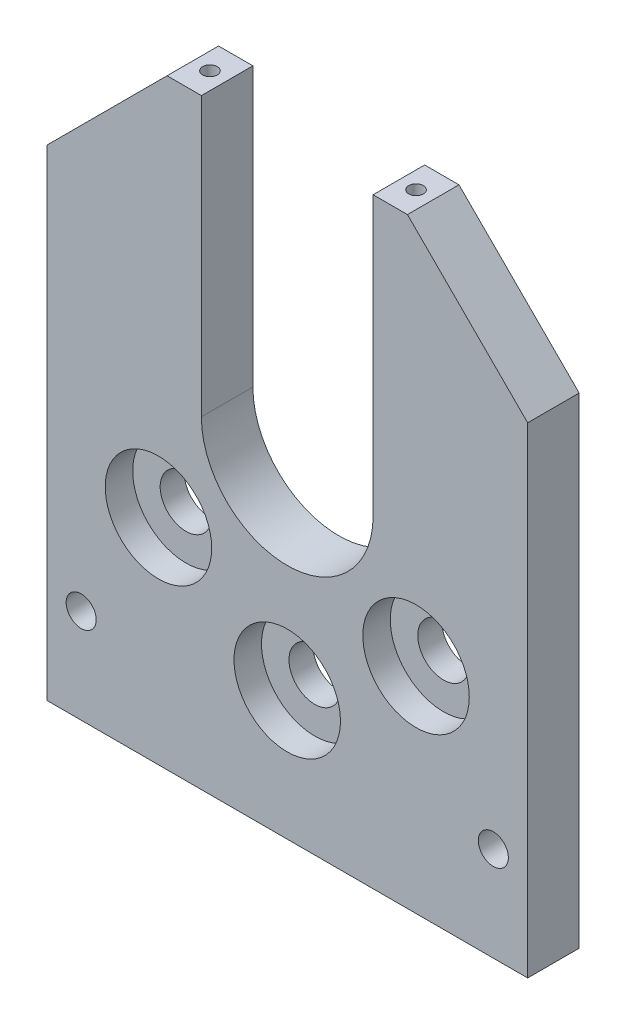
from build123d import *

# Parameters (mm, degrees)
SKETCH2_W              = 280
SKETCH2_H              = 30
BOSS_EXTRUDE2_DEPTH    = 350
CUT_EXTRUDE1_DEPTH     = 350
CHAMFER1_SIZE          = 70
M10_TAPPED_HOLE1_D     = 8.5
M10_TAPPED_HOLE1_DEPTH = 24
M10_TAPPED_HOLE1_TIP   = 4.25
SKETCH8_R              = 8.75
CUT_EXTRUDE2_DEPTH     = 350
SKETCH9_R              = 15
CUT_EXTRUDE3_DEPTH     = 350
SKETCH10_R             = 31
CUT_EXTRUDE4_DEPTH     = 16


with BuildPart() as part:
    # Sketch2 → Boss-Extrude2 (new body)
    with BuildSketch(Plane(origin=(0, 0, 0), x_dir=(1, 0, 0), z_dir=(0, 1, 0))):
        Rectangle(SKETCH2_W, SKETCH2_H)
    extrude(amount=BOSS_EXTRUDE2_DEPTH)

    # Sketch4 → Cut-Extrude1 (cut)
    with BuildSketch(Plane.XY.offset(15)):
        with BuildLine():
            Line((50, 350), (0, 350))
            Line((0, 350), (0, 138))
            ThreePointArc((0, 138), (35.355339059, 152.644660941), (50, 188))
            Line((50, 188), (50, 350))
        make_face()
        with BuildLine():
            Line((0, 138), (0, 350))
            Line((0, 350), (-50, 350))
            Line((-50, 350), (-50, 188))
            ThreePointArc((-50, 188), (-35.355339059, 152.644660941), (0, 138))
        make_face()
        with BuildLine():
            ThreePointArc((50, 350), (35.355339059, 385.355339059), (0, 400))
            Line((0, 400), (0, 350))
            Line((0, 350), (50, 350))
        make_face()
        with BuildLine():
            Line((0, 350), (0, 400))
            ThreePointArc((0, 400), (-35.355339059, 385.355339059), (-50, 350))
            Line((-50, 350), (0, 350))
        make_face()
    extrude(amount=-CUT_EXTRUDE1_DEPTH, mode=Mode.SUBTRACT)

    # Chamfer1
    chamfer1_edges = [part.edges().sort_by_distance(p)[0] for p in [
        (140, 350, 0),
        (-140, 350, 0),
    ]]
    chamfer(chamfer1_edges, length=CHAMFER1_SIZE)

    # M10 Tapped Hole1
    with Locations(Plane(origin=(-60, 350, 0), x_dir=(0, 0, 1), z_dir=(0, 1, 0))):
        with Locations((0, 0), (0, 120)):
            Hole(M10_TAPPED_HOLE1_D / 2, depth=M10_TAPPED_HOLE1_DEPTH)
            with Locations((0, 0, -(M10_TAPPED_HOLE1_DEPTH + M10_TAPPED_HOLE1_TIP / 2))):  # 90° drill point
                Cone(0, M10_TAPPED_HOLE1_D / 2, M10_TAPPED_HOLE1_TIP, mode=Mode.SUBTRACT)

    # Sketch8 → Cut-Extrude2 (cut)
    with BuildSketch(Plane.XY.offset(15)):
        with Locations((-120, 55)):
            Circle(SKETCH8_R)
        with Locations((120, 55)):
            Circle(SKETCH8_R)
    extrude(amount=-CUT_EXTRUDE2_DEPTH, mode=Mode.SUBTRACT)

    # Sketch9 → Cut-Extrude3 (cut)
    with BuildSketch(Plane.XY.offset(15)):
        with Locations((-75, 124.749371855)):
            Circle(SKETCH9_R)
        with Locations((75, 124.749371855)):
            Circle(SKETCH9_R)
        with Locations((0, 75)):
            Circle(SKETCH9_R)
    extrude(amount=-CUT_EXTRUDE3_DEPTH, mode=Mode.SUBTRACT)

    # Sketch10 → Cut-Extrude4 (cut)
    with BuildSketch(Plane.XY.offset(15)):
        with Locations((-75, 124.749371855)):
            Circle(SKETCH10_R)
        with Locations((0, 75)):
            Circle(SKETCH10_R)
        with Locations((75, 124.749371855)):
            Circle(SKETCH10_R)
    extrude(amount=-CUT_EXTRUDE4_DEPTH, mode=Mode.SUBTRACT)


solid = part.part
